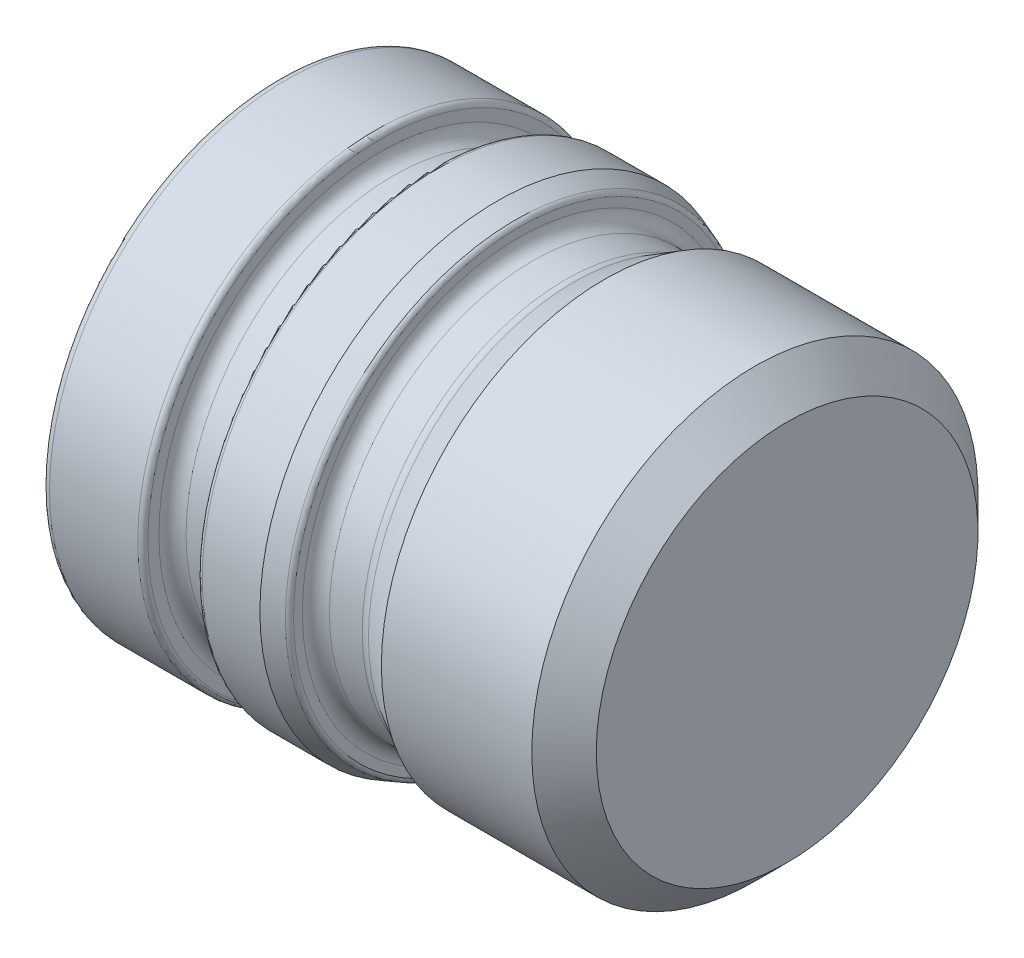
from build123d import *

# Parameters (mm, degrees)
SKETCH2_W          = 10
SKETCH2_H          = 9.75
CUT_EXTRUDE1_DEPTH = 10
SKETCH3_R          = 1.75
CUT_EXTRUDE2_DEPTH = 10
CHAMFER1_SIZE      = 0.5


with BuildPart() as part:
    # Sketch1 → Revolve1 (revolve)
    with BuildSketch(Plane.XY, mode=Mode.PRIVATE) as revolve1_sk:
        with BuildLine():
            Line((0, 0), (0, 11.25))
            Line((0, 11.25), (-1.9, 13.15))
            Line((-1.9, 13.15), (-10.764840301, 13.15))
            Line((-10.764840301, 13.15), (-12.567949192, 12.108974596))
            ThreePointArc((-12.567949192, 12.108974596), (-12.809130147, 12.009074174), (-13.067949192, 11.975))
            Line((-13.067949192, 11.975), (-15, 11.975))
            ThreePointArc((-15, 11.975), (-15.565685425, 12.209314575), (-15.8, 12.775))
            Line((-15.8, 12.775), (-15.8, 13.291776434))
            ThreePointArc((-15.8, 13.291776434), (-15.854254387, 13.463849365), (-15.997393957, 13.57368422))
            Line((-15.997393957, 13.57368422), (-17.1, 13.975))
            Line((-17.1, 13.975), (-20.5, 13.975))
            ThreePointArc((-20.5, 13.975), (-20.712132034, 13.887132034), (-20.8, 13.675))
            Line((-20.8, 13.675), (-20.8, 13.025))
            ThreePointArc((-20.8, 13.025), (-21.034314575, 12.459314575), (-21.6, 12.225))
            Line((-21.6, 12.225), (-23.2, 12.225))
            ThreePointArc((-23.2, 12.225), (-23.765685425, 12.459314575), (-24, 13.025))
            Line((-24, 13.025), (-24, 13.675))
            ThreePointArc((-24, 13.675), (-24.087867966, 13.887132034), (-24.3, 13.975))
            Line((-24.3, 13.975), (-29.5, 13.975))
            ThreePointArc((-29.5, 13.975), (-29.853553391, 13.828553391), (-30, 13.475))
            Line((-30, 13.475), (-30, 0))
            Line((-30, 0), (0, 0))
        make_face()
    revolve(revolve1_sk.sketch.rotate(Axis((0, 0, 0), (1, 0, 0)), 90), axis=Axis((0, 0, 0), (1, 0, 0)))

    # Sketch2 → Cut-Extrude1 (cut)
    with BuildSketch(Plane.ZY.offset(30)):
        with Locations((0, 0.125)):
            Rectangle(SKETCH2_W, SKETCH2_H)
    extrude(amount=-CUT_EXTRUDE1_DEPTH, mode=Mode.SUBTRACT)

    # Sketch3 → Cut-Extrude2 (cut)
    with BuildSketch(Plane.ZY.offset(30)):
        with Locations((-3.8, 3.8)):
            Circle(SKETCH3_R)
        with Locations((3.8, 3.8)):
            Circle(SKETCH3_R)
        with Locations((-3.8, -3.8)):
            Circle(SKETCH3_R)
        with Locations((3.8, -3.8)):
            Circle(SKETCH3_R)
    extrude(amount=-CUT_EXTRUDE2_DEPTH, mode=Mode.SUBTRACT)

    # Chamfer1
    chamfer1_edges = [part.edges().sort_by_distance(p)[0] for p in [
        (-30, -4.75, 0),
        (-30, 0, 5),
        (-30, 5, 0),
        (-30, 0, -5),
        (-30, 5.037436867, 5.037436867),
        (-30, -5.144627716, -4.920034064),
        (-30, -5.144627716, 4.920034064),
        (-30, 5.037436867, -5.037436867),
    ]]
    chamfer(chamfer1_edges, length=CHAMFER1_SIZE)


solid = part.part
